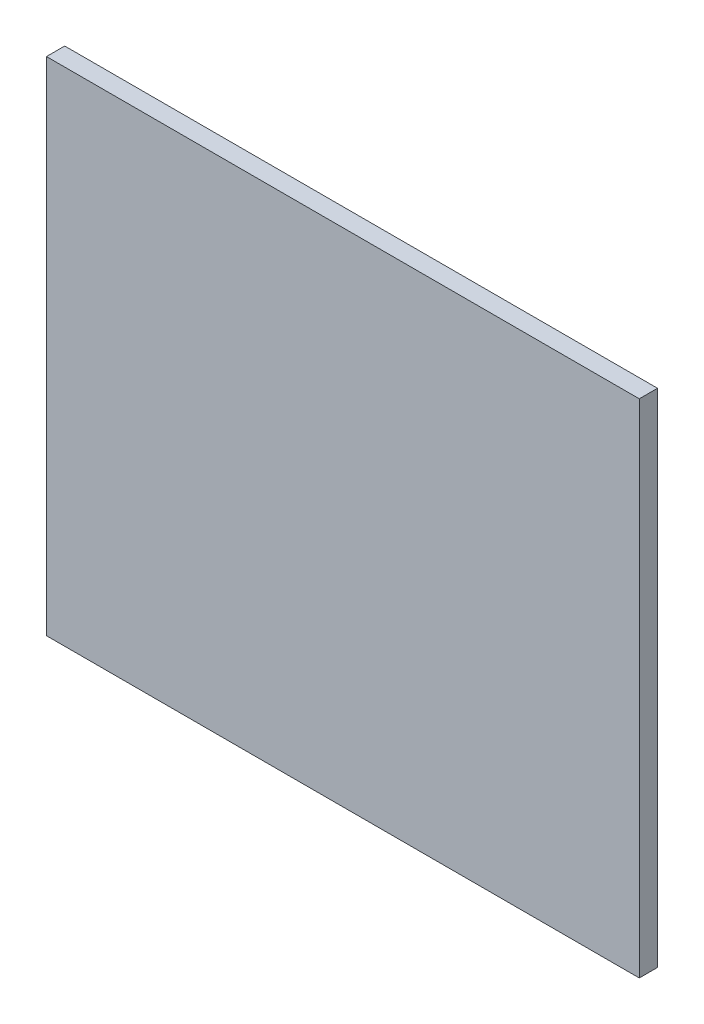
from build123d import *

# Parameters (mm, degrees)
EXTRUDE_START      = 36
EXTRUDE_SKETCH_1_W = 130
EXTRUDE_SKETCH_1_H = 110
EXTRUDE_1_DEPTH    = 4


with BuildPart() as part:
    # Extrude sketch 1 → Extrude 1 (new body)
    with BuildSketch(Plane.XY.offset(EXTRUDE_START)):
        with Locations((120, 0)):
            Rectangle(EXTRUDE_SKETCH_1_W, EXTRUDE_SKETCH_1_H)
    extrude(amount=EXTRUDE_1_DEPTH)


solid = part.part
